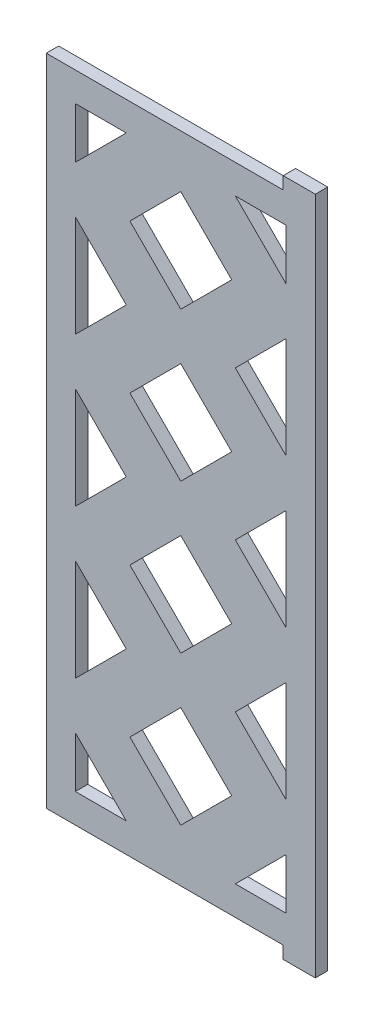
from build123d import *

# Parameters (mm, degrees)
SALIENTE_EXTRUIR1_DEPTH = 3


with BuildPart() as part:
    # Croquis1 → Saliente-Extruir1 (new body)
    with BuildSketch(Plane.XY):
        Polygon((-32.5, 0), (24.75, 0), (24.75, 3), (32.5, 3), (32.5, 0), (32.5, -158), (32.5, -161), (24.75, -161), (24.75, -158), (-32.5, -158), align=None)
        Polygon((-13.175, -7.03), (-25.475, -19.33), (-25.475, -7.03), align=None, mode=Mode.SUBTRACT)
        Polygon((13.175, -7.03), (25.475, -7.03), (25.475, -19.33), align=None, mode=Mode.SUBTRACT)
        Polygon((13.175, -79), (25.475, -66.7), (25.475, -91.3), align=None, mode=Mode.SUBTRACT)
        Polygon((13.175, -150.97), (25.475, -138.67), (25.475, -150.97), align=None, mode=Mode.SUBTRACT)
        Polygon((-13.175, -79), (-25.475, -66.7), (-25.475, -91.3), align=None, mode=Mode.SUBTRACT)
        Polygon((13.175, -43.015), (25.475, -55.315), (25.475, -30.715), align=None, mode=Mode.SUBTRACT)
        Polygon((-13.175, -43.015), (-25.475, -30.715), (-25.475, -55.315), align=None, mode=Mode.SUBTRACT)
        Polygon((0, -48.7075), (-12.3, -61.0075), (0, -73.3075), (12.3, -61.0075), align=None, mode=Mode.SUBTRACT)
        Polygon((0, -12.7225), (12.3, -25.0225), (0, -37.3225), (-12.3, -25.0225), align=None, mode=Mode.SUBTRACT)
        Polygon((-13.175, -150.97), (-25.475, -150.97), (-25.475, -138.67), align=None, mode=Mode.SUBTRACT)
        Polygon((-13.175, -114.985), (-25.475, -127.285), (-25.475, -102.685), align=None, mode=Mode.SUBTRACT)
        Polygon((-12.3, -132.9775), (0, -145.2775), (12.3, -132.9775), (0, -120.6775), align=None, mode=Mode.SUBTRACT)
        Polygon((13.175, -114.985), (25.475, -127.285), (25.475, -102.685), align=None, mode=Mode.SUBTRACT)
        Polygon((0, -84.6925), (12.3, -96.9925), (0, -109.2925), (-12.3, -96.9925), align=None, mode=Mode.SUBTRACT)
    extrude(amount=SALIENTE_EXTRUIR1_DEPTH)


solid = part.part
